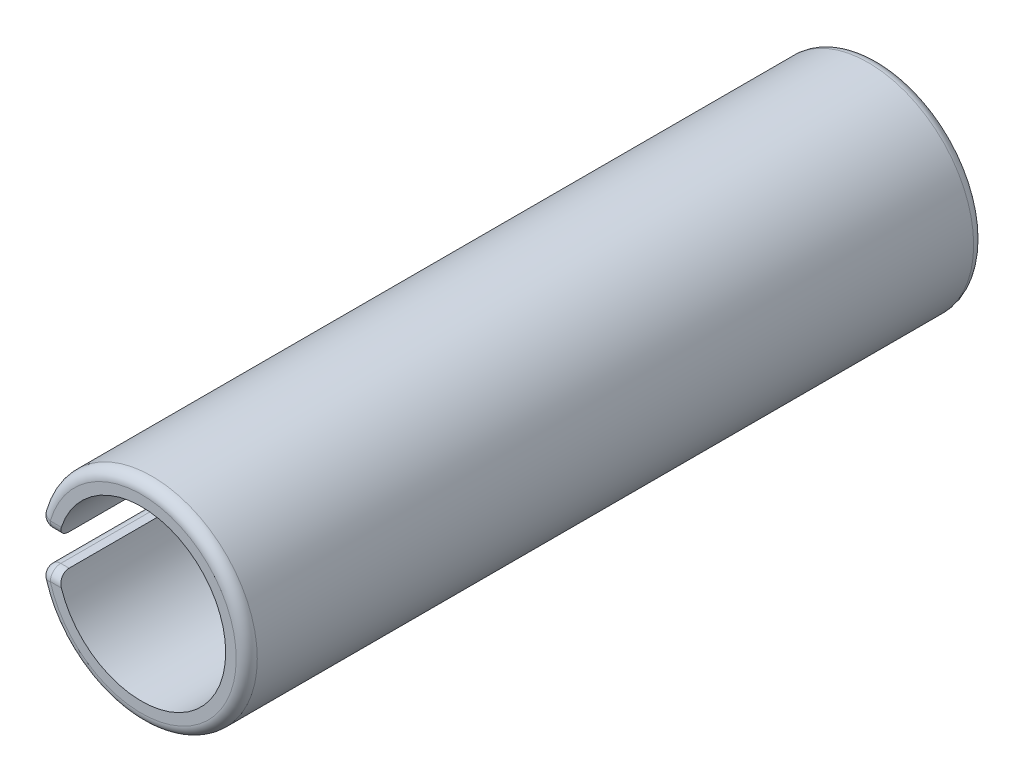
from build123d import *

# Parameters (mm, degrees)
RESSALTO_EXTRUS_O1_DEPTH = 7
FILETE1_R                = 0.1


with BuildPart() as part:
    # Esboço1 → Ressalto-extrusão1 (new body)
    with BuildSketch(Plane.XY):
        with BuildLine():
            Line((-0.865023226, 0.149597058), (-0.7859375, 0.149339366))
            ThreePointArc((-0.7859375, 0.149339366), (0.8, 0), (-0.7859375, -0.149339366))
            Line((-0.7859375, -0.149339366), (-0.865023226, -0.149597058))
            ThreePointArc((-0.865023226, -0.149597058), (-0.944711717, -0.189615637), (-0.960774876, -0.277329475))
            ThreePointArc((-0.960774876, -0.277329475), (1, 0), (-0.960774876, 0.277329475))
            ThreePointArc((-0.960774876, 0.277329475), (-0.944711717, 0.189615637), (-0.865023226, 0.149597058))
        make_face()
    extrude(amount=RESSALTO_EXTRUS_O1_DEPTH)

    # Filete1
    filete1_edges = [part.edges().sort_by_distance(p)[0] for p in [
        (-0.944711717, -0.189615637, 7),
        (1, 0, 7),
        (-0.944711717, 0.189615637, 7),
        (-0.825480363, 0.149468212, 7),
        (-0.825480363, 0.149468212, 0),
        (-0.944711717, 0.189615637, 0),
        (1, 0, 0),
        (-0.825480363, -0.149468212, 7),
        (-0.944711717, -0.189615637, 0),
        (-0.825480363, -0.149468212, 0),
    ]]
    fillet(filete1_edges, radius=FILETE1_R)


solid = part.part
